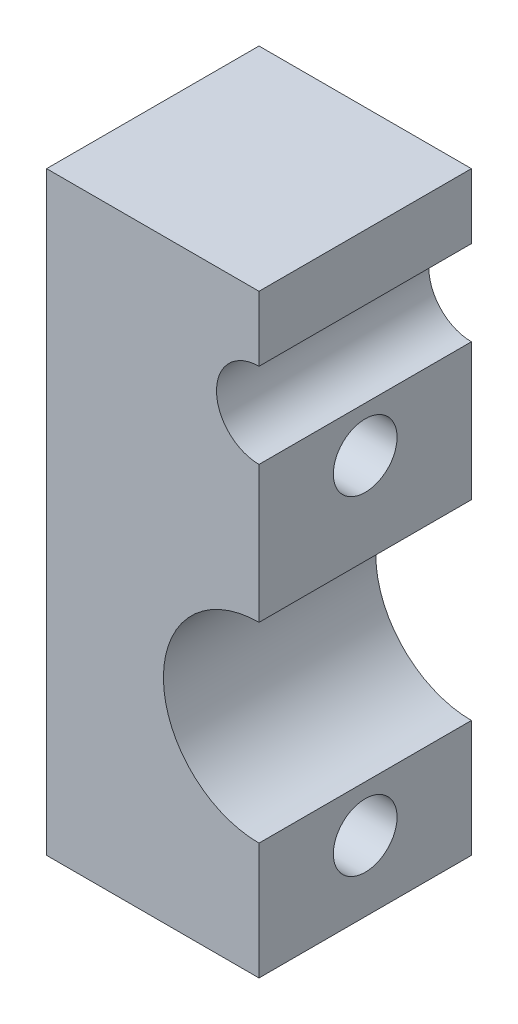
from build123d import *

# Parameters (mm, degrees)
SKETCH_1_W            = 10
SKETCH_1_H            = 10
EXTRUDE_1_DEPTH       = 28
SKETCH_2_R            = 4.499999995
CUT_EXTRUDE_2_DEPTH   = 31.149626863
SKETCH_3_R            = 1.5
CUT_EXTRUDE_1_DEPTH   = 31.149626863
SKETCH_4_R            = 1.999999994
CUT_EXTRUDE_2_2_DEPTH = 31.149626863


with BuildPart() as part:
    # Эскиз1 → Вытянуть1 (new body)
    with BuildSketch(Plane(origin=(0, 0, 0), x_dir=(1, 0, 0), z_dir=(0, 1, 0))):
        Rectangle(SKETCH_1_W, SKETCH_1_H)
    extrude(amount=EXTRUDE_1_DEPTH)

    # Эскиз2 → Cut-Extrude 2 (cut, through all)
    with BuildSketch(Plane.XY.offset(5)):
        with Locations((5.000000005, 10.000000001)):
            Circle(SKETCH_2_R)
    extrude(amount=-CUT_EXTRUDE_2_DEPTH, mode=Mode.SUBTRACT)

    # Эскиз3 → Вырез-Вытянуть1 (cut, through all)
    with BuildSketch(Plane(origin=(5, 0, 0), x_dir=(0, 0, -1), z_dir=(1, 0, 0))):
        with Locations((0, 3.309697202)):
            Circle(SKETCH_3_R)
        with Locations((0, 18.798896008)):
            Circle(SKETCH_3_R)
    extrude(amount=-CUT_EXTRUDE_1_DEPTH, mode=Mode.SUBTRACT)

    # Эскиз4 → Cut-Extrude 2 2 (cut, through all)
    with BuildSketch(Plane.XY.offset(5)):
        with Locations((4.999999971, 22.940656165)):
            Circle(SKETCH_4_R)
    extrude(amount=-CUT_EXTRUDE_2_2_DEPTH, mode=Mode.SUBTRACT)


solid = part.part
